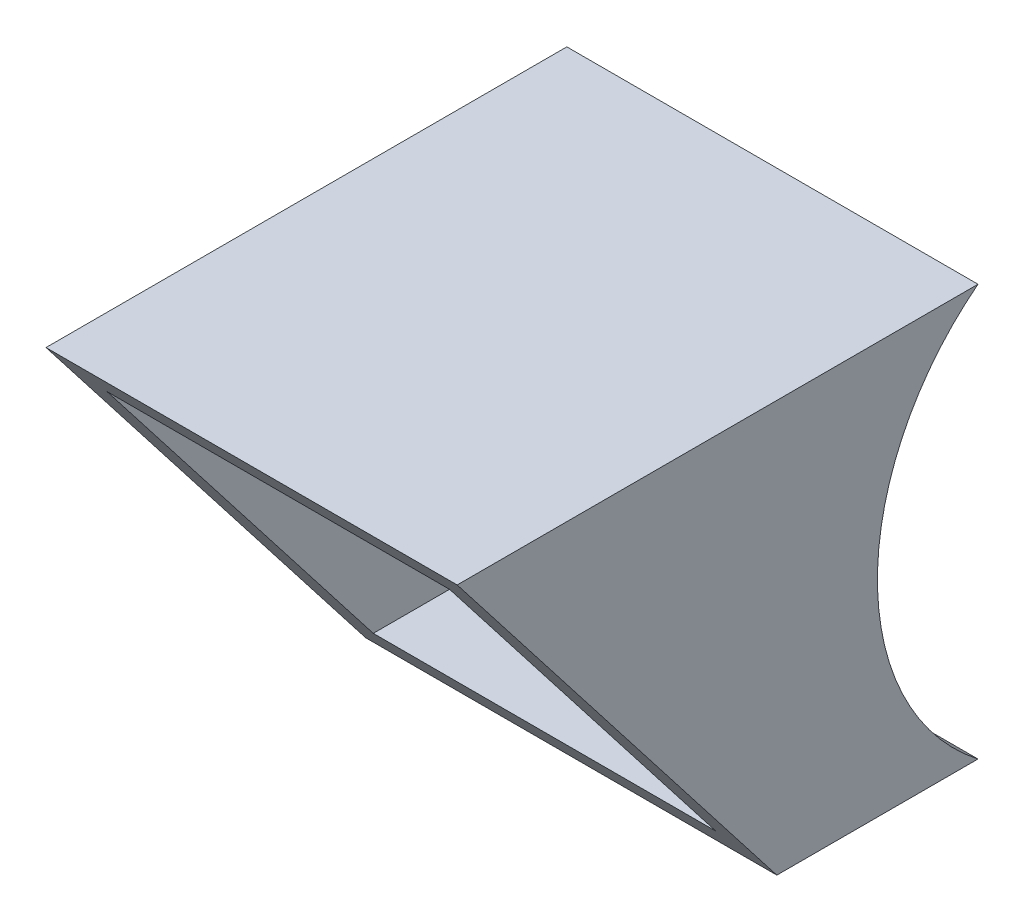
from build123d import *

# Parameters (mm, degrees)
BOSS_EXTRUDE1_DEPTH = 38.1
SKETCH2_W           = 31.75
SKETCH2_H           = 31.75
CUT_EXTRUDE1_DEPTH  = 73.334276799


with BuildPart() as part:
    # Sketch1 → Boss-Extrude1 (new body)
    with BuildSketch(Plane(origin=(0, 0, 0), x_dir=(0, 0, -1), z_dir=(1, 0, 0))):
        with BuildLine():
            Line((48.26, 38.1), (0, 38.1))
            Line((0, 38.1), (29.621235626, 0))
            Line((29.621235626, 0), (48.26, 0))
            ThreePointArc((48.26, 0), (38.940617813, 19.05), (48.26, 38.1))
        make_face()
    extrude(amount=BOSS_EXTRUDE1_DEPTH)

    # Sketch2 → Cut-Extrude1 (cut, through all)
    with BuildSketch(Plane.XY):
        with Locations((19.05, 19.05)):
            Rectangle(SKETCH2_W, SKETCH2_H)
    extrude(amount=-CUT_EXTRUDE1_DEPTH, mode=Mode.SUBTRACT)


solid = part.part
